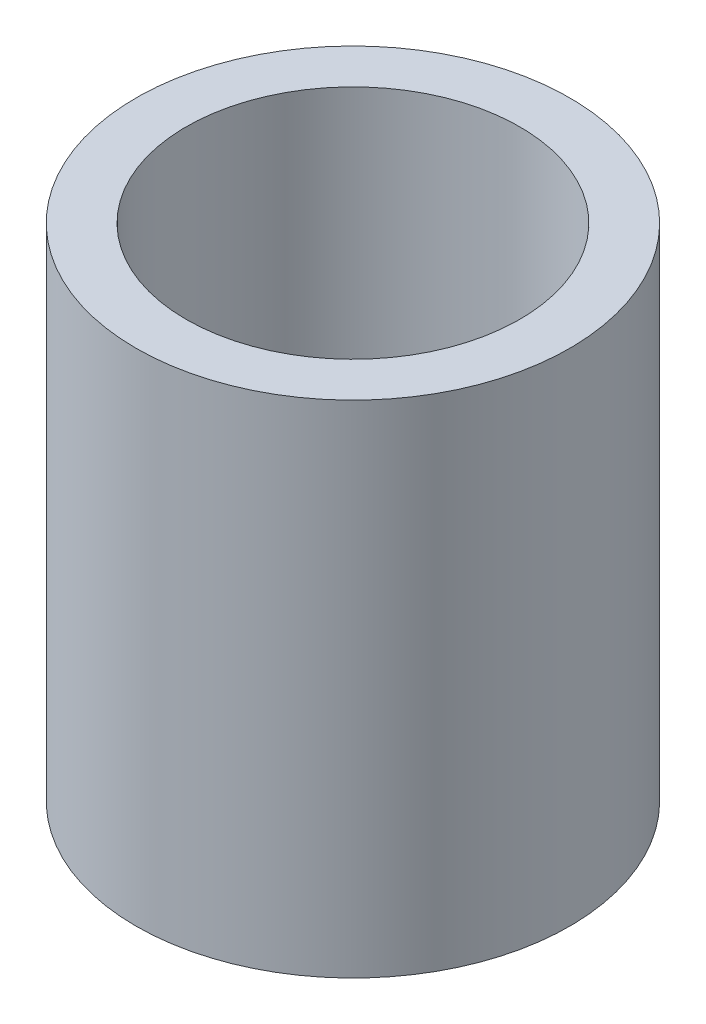
from build123d import *

# Parameters (mm, degrees)
SKETCH1_R           = 13
SKETCH1_R_2         = 10
BOSS_EXTRUDE1_DEPTH = 30


with BuildPart() as part:
    # Sketch1 → Boss-Extrude1 (new body)
    with BuildSketch(Plane(origin=(0, 0, 0), x_dir=(1, 0, 0), z_dir=(0, 1, 0))):
        with Locations(Location((0, 0, 0), (0, 0, 270))):
            Circle(SKETCH1_R)
        with Locations(Location((0, 0, 0), (0, 0, 270))):
            Circle(SKETCH1_R_2, mode=Mode.SUBTRACT)
    extrude(amount=BOSS_EXTRUDE1_DEPTH)


solid = part.part
